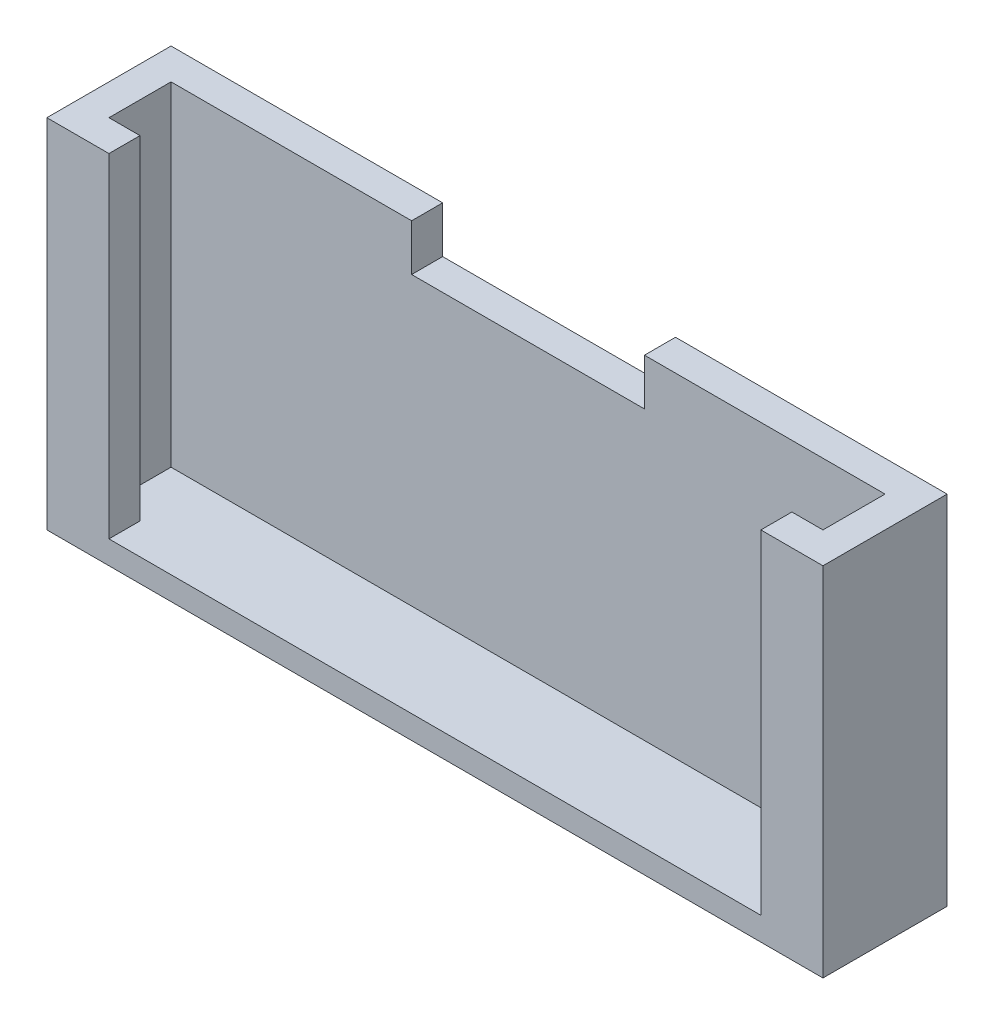
from build123d import *

# Parameters (mm, degrees)
SKETCH1_W           = 50
SKETCH1_H           = 23
BOSS_EXTRUDE1_DEPTH = 2
SKETCH2_W           = 50
SKETCH2_H           = 23
BOSS_EXTRUDE2_DEPTH = 6
SKETCH3_W           = 46
SKETCH3_H           = 20
CUT_EXTRUDE1_DEPTH  = 4
SKETCH4_W           = 46
SKETCH4_H           = 4
CUT_EXTRUDE2_DEPTH  = 4
SKETCH5_W           = 46
SKETCH5_H           = 21.5
CUT_EXTRUDE3_DEPTH  = 2
SKETCH6_W           = 2
SKETCH6_H           = 21.5
BOSS_EXTRUDE3_DEPTH = 2
SKETCH7_W           = 2
SKETCH7_H           = 21.5
BOSS_EXTRUDE4_DEPTH = 2
SKETCH8_W           = 15
SKETCH8_H           = 6
CUT_EXTRUDE5_DEPTH  = 2


with BuildPart() as part:
    # Sketch1 → Boss-Extrude1 (new body)
    with BuildSketch(Plane.XY):
        Rectangle(SKETCH1_W, SKETCH1_H)
    extrude(amount=BOSS_EXTRUDE1_DEPTH)

    # Sketch2 → Boss-Extrude2 (add)
    with BuildSketch(Plane.XY.offset(2)):
        Rectangle(SKETCH2_W, SKETCH2_H)
    extrude(amount=BOSS_EXTRUDE2_DEPTH)

    # Sketch3 → Cut-Extrude1 (cut)
    with BuildSketch(Plane.XY.offset(8)):
        Rectangle(SKETCH3_W, SKETCH3_H)
    extrude(amount=-CUT_EXTRUDE1_DEPTH, mode=Mode.SUBTRACT)

    # Sketch4 → Cut-Extrude2 (cut)
    with BuildSketch(Plane.XZ.offset(-10)):
        with Locations((0, 6)):
            Rectangle(SKETCH4_W, SKETCH4_H)
    extrude(amount=-CUT_EXTRUDE2_DEPTH, mode=Mode.SUBTRACT)

    # Sketch5 → Cut-Extrude3 (cut)
    with BuildSketch(Plane.XY.offset(4)):
        with Locations((0, 0.75)):
            Rectangle(SKETCH5_W, SKETCH5_H)
    extrude(amount=-CUT_EXTRUDE3_DEPTH, mode=Mode.SUBTRACT)

    # Sketch6 → Boss-Extrude3 (add)
    with BuildSketch(Plane.ZY.offset(-23)):
        with Locations((7, 0.75)):
            Rectangle(SKETCH6_W, SKETCH6_H)
    extrude(amount=BOSS_EXTRUDE3_DEPTH)

    # Sketch7 → Boss-Extrude4 (add)
    with BuildSketch(Plane(origin=(-23, 0, 0), x_dir=(0, 0, -1), z_dir=(1, 0, 0))):
        with Locations((-7, 0.75)):
            Rectangle(SKETCH7_W, SKETCH7_H)
    extrude(amount=BOSS_EXTRUDE4_DEPTH)

    # Sketch8 → Cut-Extrude5 (cut)
    with BuildSketch(Plane.XY.offset(2)):
        with Locations((0, 11.5)):
            Rectangle(SKETCH8_W, SKETCH8_H)
    extrude(amount=-CUT_EXTRUDE5_DEPTH, mode=Mode.SUBTRACT)


solid = part.part
